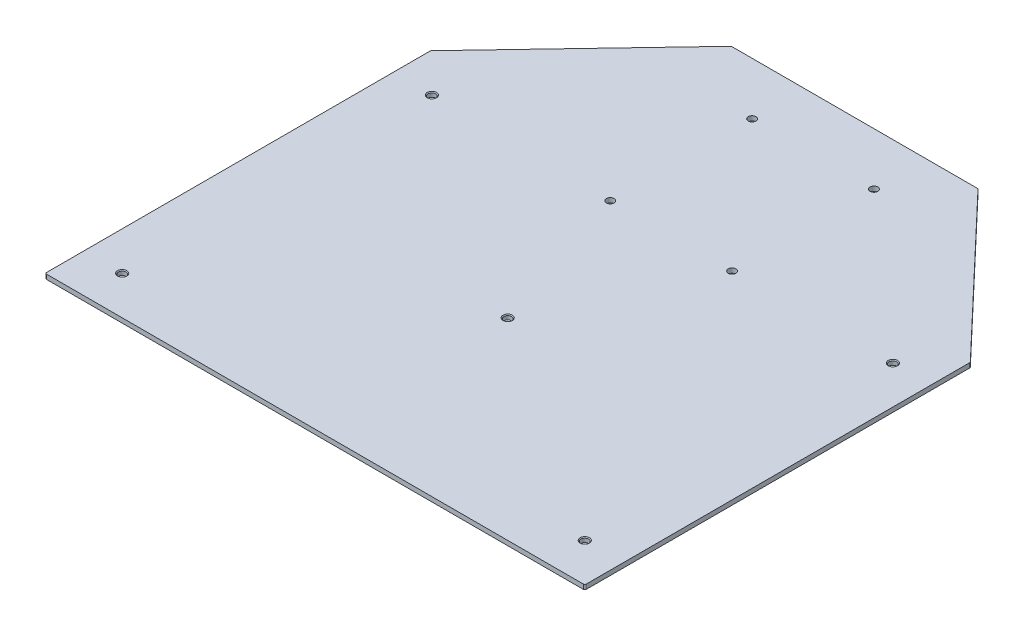
from build123d import *

# Parameters (mm, degrees)
PLATE_EXTRUDE_1_DEPTH             = 3
M6_TAPPED_HOLE2_AT_2_COUNT        = 2
M6_TAPPED_HOLE2_AT_2_PITCH        = 300
M6_TAPPED_HOLE2_AT_3_COUNT        = 2
M6_TAPPED_HOLE2_AT_3_PITCH        = 180.277563773
M6_TAPPED_HOLE2_AT_4_COUNT        = 2
M6_TAPPED_HOLE2_AT_4_PITCH        = 200.51462203
M6_TAPPED_HOLE2_AT_5_COUNT        = 2
M6_TAPPED_HOLE2_AT_5_PITCH        = 360.55459645
TAP_DRILL_FOR_M6_TAP1_D           = 5
TAP_DRILL_FOR_M6_TAP1_DEPTH       = 10
TAP_DRILL_FOR_M6_TAP1_CSINK_D     = 5.05
TAP_DRILL_FOR_M6_TAP1_CSINK_ANGLE = 90
TAP_DRILL_FOR_M6_TAP1_TIP         = 1.502151548


with BuildPart() as part:
    # Plate Template → Plate Extrude 1 (new body)
    with BuildSketch(Plane(origin=(0, 0, 0), x_dir=(1, 0, 0), z_dir=(0, 1, 0))):
        with BuildLine():
            Line((-79.570676183, 225.004191897), (79.570676183, 225.004191897))
            ThreePointArc((79.570676183, 225.004191897), (79.965179487, 224.92308642), (80.295690033, 224.692926184))
            Line((80.295690033, 224.692926184), (174.72501385, 125.289471239))
            ThreePointArc((174.72501385, 125.289471239), (174.928712509, 124.971537539), (175, 124.600736953))
            Line((175, 124.600736953), (175, -124))
            ThreePointArc((175, -124), (174.707106781, -124.707106781), (174, -125))
            Line((174, -125), (-174, -125))
            ThreePointArc((-174, -125), (-174.707106781, -124.707106781), (-175, -124))
            Line((-175, -124), (-175, 124.600736953))
            ThreePointArc((-175, 124.600736953), (-174.928712509, 124.971537539), (-174.72501385, 125.289471239))
            Line((-174.72501385, 125.289471239), (-80.295690033, 224.692926184))
            ThreePointArc((-80.295690033, 224.692926184), (-79.965179487, 224.92308642), (-79.570676183, 225.004191897))
        make_face()
    extrude(amount=PLATE_EXTRUDE_1_DEPTH)

    # Sketch3 → M6 Tapped Hole2 (revolve, cut)
    with BuildSketch(Plane(origin=(-150, 3, 100), x_dir=(0, 0, 1), z_dir=(1, 0, 0))):
        Polygon((0, 0), (0, 3), (2.5, 3), (2.5, 0.525), (3.025, 0), align=None)
    m6_tapped_hole2 = revolve(axis=Axis((-150, 9.35, 100), (0, -1, 0)), mode=Mode.SUBTRACT)

    # M6 Tapped Hole2 at 2: M6 Tapped Hole2 ×2
    with Locations(*[(i * M6_TAPPED_HOLE2_AT_2_PITCH, 0, 0) for i in range(1, M6_TAPPED_HOLE2_AT_2_COUNT)]):
        add(m6_tapped_hole2, mode=Mode.SUBTRACT)

    # M6 Tapped Hole2 at 3: M6 Tapped Hole2 ×2
    with Locations(*[Vector(0.8320502943378437, 0, -0.554700196225229) * (i * M6_TAPPED_HOLE2_AT_3_PITCH) for i in range(1, M6_TAPPED_HOLE2_AT_3_COUNT)]):
        add(m6_tapped_hole2, mode=Mode.SUBTRACT)

    # M6 Tapped Hole2 at 4: M6 Tapped Hole2 ×2
    with Locations(*[Vector(0.0017163887650713508, 0, -0.9999985270037187) * (i * M6_TAPPED_HOLE2_AT_4_PITCH) for i in range(1, M6_TAPPED_HOLE2_AT_4_COUNT)]):
        add(m6_tapped_hole2, mode=Mode.SUBTRACT)

    # M6 Tapped Hole2 at 5: M6 Tapped Hole2 ×2
    with Locations(*[Vector(0.8330011499156382, 0, -0.5532712573767269) * (i * M6_TAPPED_HOLE2_AT_5_PITCH) for i in range(1, M6_TAPPED_HOLE2_AT_5_COUNT)]):
        add(m6_tapped_hole2, mode=Mode.SUBTRACT)

    # Tap Drill for M6 Tap1
    with Locations(Plane(origin=(0, 0, 0), x_dir=(-1, 0, 0), z_dir=(0, -1, 0))):
        with Locations((-46.5, 191.004191906), (32.5, 191.004191906), (32.5, 99.004191897), (-46.5, 99.004191897)):
            CounterSinkHole(TAP_DRILL_FOR_M6_TAP1_D / 2, TAP_DRILL_FOR_M6_TAP1_CSINK_D / 2, depth=TAP_DRILL_FOR_M6_TAP1_DEPTH, counter_sink_angle=TAP_DRILL_FOR_M6_TAP1_CSINK_ANGLE)
            with Locations((0, 0, -(TAP_DRILL_FOR_M6_TAP1_DEPTH + TAP_DRILL_FOR_M6_TAP1_TIP / 2))):  # 118° drill point
                Cone(0, TAP_DRILL_FOR_M6_TAP1_D / 2, TAP_DRILL_FOR_M6_TAP1_TIP, mode=Mode.SUBTRACT)


solid = part.part
